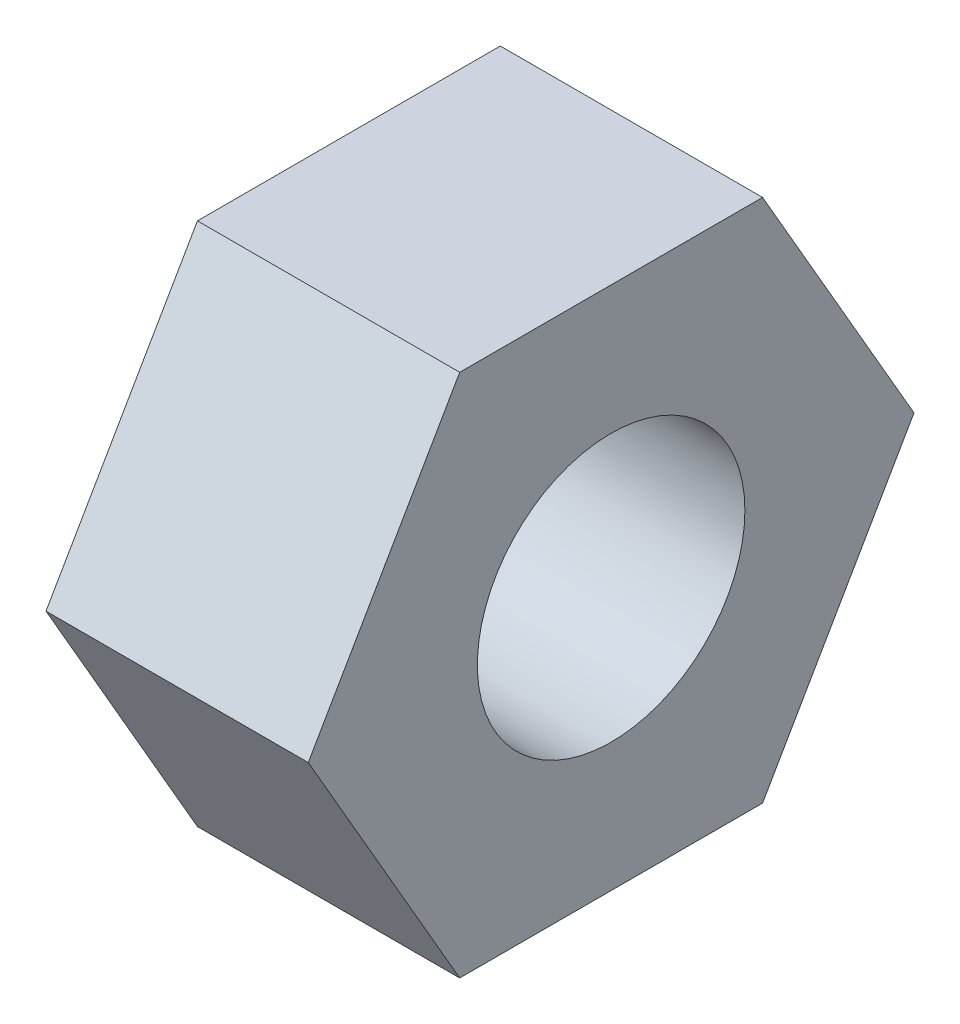
from build123d import *

# Parameters (mm, degrees)
SKETCH_1_R         = 5.1
F_01_HEX_M12_DEPTH = 10


with BuildPart() as part:
    # 草图1 → 01_HEX_M12 (new body)
    with BuildSketch(Plane(origin=(0, 0, 0), x_dir=(0, 0, -1), z_dir=(1, 0, 0))):
        Polygon((11.547005384, 0), (5.773502692, 10), (-5.773502692, 10), (-11.547005384, 0), (-5.773502692, -10), (5.773502692, -10), align=None)
        Circle(SKETCH_1_R, mode=Mode.SUBTRACT)
    extrude(amount=F_01_HEX_M12_DEPTH)


solid = part.part
